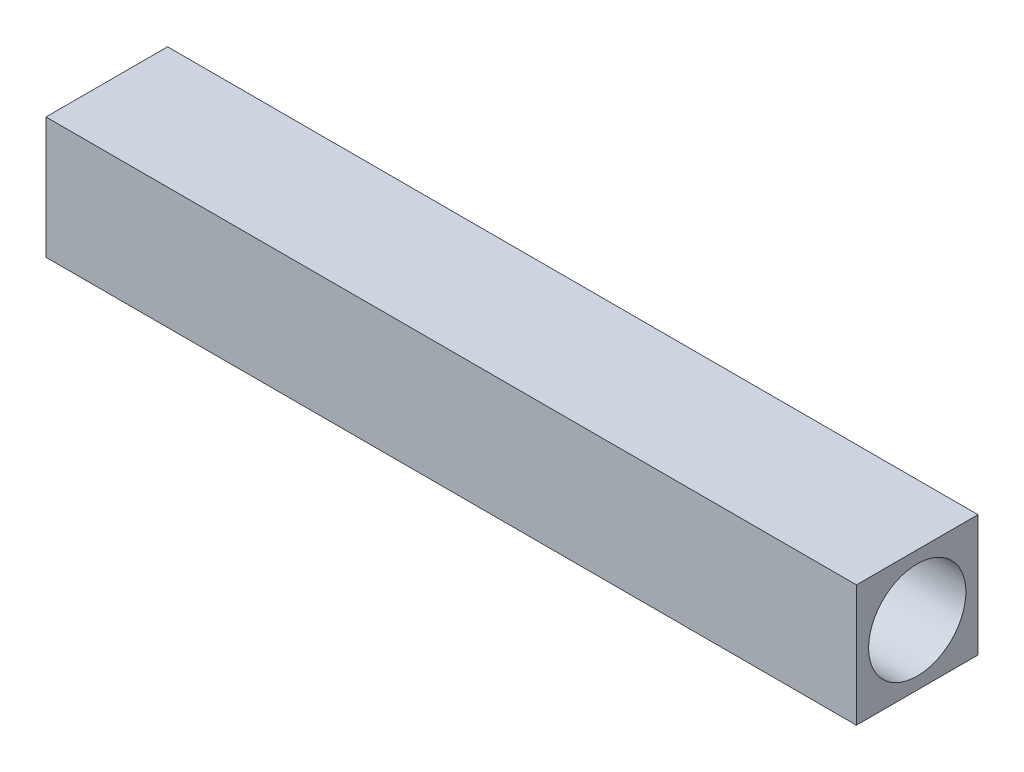
from build123d import *

# Parameters (mm, degrees)
SKETCH1_W           = 95.25
SKETCH1_H           = 95.25
SKETCH1_R           = 38.1
BOSS_EXTRUDE1_DEPTH = 317.5


with BuildPart() as part:
    # Sketch1 → Boss-Extrude1 (new, symmetric)
    with BuildSketch(Plane(origin=(0, 0, 0), x_dir=(0, 0, -1), z_dir=(1, 0, 0))):
        with Locations((-47.625, 47.625)):
            Rectangle(SKETCH1_W, SKETCH1_H)
        with Locations(Location((-47.625, 47.625, 0), (0, 0, 180))):
            Circle(SKETCH1_R, mode=Mode.SUBTRACT)
    extrude(amount=BOSS_EXTRUDE1_DEPTH, both=True)


solid = part.part
